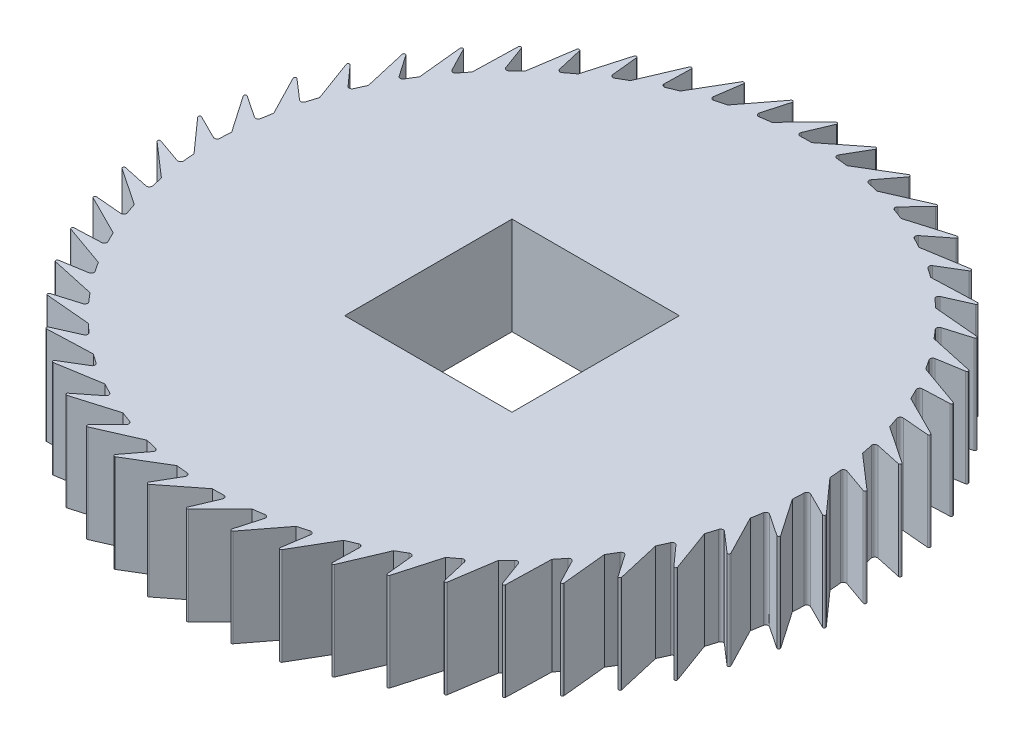
from build123d import *

# Parameters (mm, degrees)
EXTRUDE_1_DEPTH     = 7
FILLET_1_R          = 0.2
FILLET_2_R          = 0.2
FILLET_3_R          = 0.2
FILLET_4_R          = 0.2
FILLET_6_R          = 0.1
FILLET_7_R          = 0.1
FILLET_8_R          = 0.1
FILLET_9_R          = 0.1
SKETCH_2_W          = 12
SKETCH_2_H          = 12
CUT_EXTRUDE_1_DEPTH = 7


with BuildPart() as part:
    # 草图1 → 凸台-拉伸1 (new body)
    with BuildSketch(Plane(origin=(0, 0, 0), x_dir=(1, 0, 0), z_dir=(0, 1, 0))):
        with BuildLine():
            Line((0, 21.5), (2.952809581, 23.817659742))
            Line((2.952809581, 23.817659742), (1.573300118, 21.442358236))
            ThreePointArc((1.573300118, 21.442358236), (2.134715556, 21.393760527), (2.694664522, 21.330466078))
            Line((2.694664522, 21.330466078), (5.914670106, 23.259765208))
            Line((5.914670106, 23.259765208), (4.248334269, 21.076092046))
            ThreePointArc((4.248334269, 21.076092046), (4.799231871, 20.957513532), (5.346832574, 20.824537964))
            Line((5.346832574, 20.824537964), (8.783252751, 22.335050282))
            Line((8.783252751, 22.335050282), (6.856369652, 20.377443294))
            ThreePointArc((6.856369652, 20.377443294), (7.388061433, 20.190754029), (7.914677883, 19.990194447))
            Line((7.914677883, 19.990194447), (11.513318254, 21.058098271))
            Line((11.513318254, 21.058098271), (9.356275989, 19.357430088))
            ThreePointArc((9.356275989, 19.357430088), (9.860376852, 19.105574274), (10.357703993, 18.840593621))
            Line((10.357703993, 18.840593621), (14.06181185, 19.44904747))
            Line((14.06181185, 19.44904747), (11.708628265, 18.032138646))
            ThreePointArc((11.708628265, 18.032138646), (12.177188238, 17.719088199), (12.637382924, 17.393865379))
            Line((12.637382924, 17.393865379), (16.388542272, 17.533273573))
            Line((16.388542272, 17.533273573), (13.876328478, 16.422469606))
            ThreePointArc((13.876328478, 16.422469606), (14.301958092, 16.053161519), (14.717762777, 15.67282549))
            Line((14.717762777, 15.67282549), (18.456815593, 15.340989478))
            Line((18.456815593, 15.340989478), (15.825190702, 14.55380841))
            ThreePointArc((15.825190702, 14.55380841), (16.201177522, 14.134066891), (16.56603472, 13.70461578))
            Line((16.56603472, 13.70461578), (20.234013907, 12.906768814))
            Line((20.234013907, 12.906768814), (17.524480216, 12.455624961))
            ThreePointArc((17.524480216, 12.455624961), (17.844894706, 11.992069586), (18.153050398, 11.520276092))
            Line((18.153050398, 11.520276092), (21.692109734, 10.269000696))
            Line((21.692109734, 10.269000696), (18.947398207, 10.161008866))
            ThreePointArc((18.947398207, 10.161008866), (19.207187239, 9.660950179), (19.453781628, 9.154254769))
            Line((19.453781628, 9.154254769), (22.808108032, 7.469284302))
            Line((22.808108032, 7.469284302), (20.07150441, 7.706147591))
            ThreePointArc((20.07150441, 7.706147591), (20.266570956, 7.177471817), (20.4477151, 6.643865379))
            Line((20.4477151, 6.643865379), (23.564408842, 4.551772834))
            Line((23.564408842, 4.551772834), (20.879070999, 5.129755766))
            ThreePointArc((20.879070999, 5.129755766), (21.006338742, 4.580800437), (21.119175891, 4.028698264))
            Line((21.119175891, 4.028698264), (23.949084848, 1.562477188))
            Line((23.949084848, 1.562477188), (21.357362165, 2.472464627))
            ThreePointArc((21.357362165, 2.472464627), (21.414824018, 1.911887097), (21.457574661, 1.34999617))
            Line((21.457574661, 1.34999617), (23.956069479, -1.451459656))
            Line((23.956069479, -1.451459656), (21.498834972, -0.223818756))
            ThreePointArc((21.498834972, -0.223818756), (21.485584727, -0.787177844), (21.457574661, -1.34999617))
            Line((21.457574661, -1.34999617), (23.585252583, -4.442506115))
            Line((23.585252583, -4.442506115), (21.301258309, -2.916572383))
            ThreePointArc((21.301258309, -2.916572383), (21.217504929, -3.47382852), (21.119175891, -4.028698264))
            Line((21.119175891, -4.028698264), (22.842482166, -7.363491598))
            Line((22.842482166, -7.363491598), (20.767748077, -5.563329921))
            ThreePointArc((20.767748077, -5.563329921), (20.614812404, -6.105694846), (20.4477151, -6.643865379))
            Line((20.4477151, -6.643865379), (21.739472159, -10.168350419))
            Line((21.739472159, -10.168350419), (19.906718052, -8.122350423))
            ThreePointArc((19.906718052, -8.122350423), (19.687011973, -8.641270716), (19.453781628, -9.154254769))
            Line((19.453781628, -9.154254769), (20.29361769, -12.812848281))
            Line((20.29361769, -12.812848281), (18.731747192, -10.553276607))
            ThreePointArc((18.731747192, -10.553276607), (18.448735602, -11.040568585), (18.153050398, -11.520276092))
            Line((18.153050398, -11.520276092), (18.527720746, -15.255279871))
            Line((18.527720746, -15.255279871), (17.261365488, -12.817771315))
            ThreePointArc((17.261365488, -12.817771315), (16.91951165, -13.265750093), (16.56603472, -13.70461578))
            Line((16.56603472, -13.70461578), (16.469630579, -17.457126584))
            Line((16.469630579, -17.457126584), (15.51876174, -14.880122112))
            ThreePointArc((15.51876174, -14.880122112), (15.123456892, -15.281722796), (14.717762777, -15.67282549))
            Line((14.717762777, -15.67282549), (14.151804499, -19.383663983))
            Line((14.151804499, -19.383663983), (13.531417848, -16.707804495))
            ThreePointArc((13.531417848, -16.707804495), (13.088896185, -17.056693603), (12.637382924, -17.393865379))
            Line((12.637382924, -17.393865379), (11.610796009, -21.004509422))
            Line((11.610796009, -21.004509422), (11.330675413, -18.271994819))
            ThreePointArc((11.330675413, -18.271994819), (10.847915766, -18.562670162), (10.357703993, -18.840593621))
            Line((10.357703993, -18.840593621), (8.886678329, -22.294101199))
            Line((8.886678329, -22.294101199), (8.951241459, -19.548024871))
            ThreePointArc((8.951241459, -19.548024871), (8.435857235, -19.775902323), (7.914677883, -19.990194447))
            Line((7.914677883, -19.990194447), (6.022412423, -23.232101683))
            Line((6.022412423, -23.232101683), (6.43064108, -20.515770892))
            ThreePointArc((6.43064108, -20.515770892), (5.890760197, -20.677256692), (5.346832574, -20.824537964))
            Line((5.346832574, -20.824537964), (3.063169476, -23.803718045))
            Line((3.063169476, -23.803718045), (3.808625649, -21.159970951))
            ThreePointArc((3.808625649, -21.159970951), (3.25276235, -21.252518371), (2.694664522, -21.330466078))
            Line((2.694664522, -21.330466078), (0.055618516, -23.999935554))
            Line((0.055618516, -23.999935554), (1.126545917, -21.470465628))
            ThreePointArc((1.126545917, -21.470465628), (0.563466499, -21.492615139), (0, -21.5))
            Line((0, -21.5), (-2.952809581, -23.817659742))
            Line((-2.952809581, -23.817659742), (-1.573300118, -21.442358236))
            ThreePointArc((-1.573300118, -21.442358236), (-2.134715556, -21.393760527), (-2.694664522, -21.330466078))
            Line((-2.694664522, -21.330466078), (-5.914670106, -23.259765208))
            Line((-5.914670106, -23.259765208), (-4.248334269, -21.076092046))
            ThreePointArc((-4.248334269, -21.076092046), (-4.799231871, -20.957513532), (-5.346832574, -20.824537964))
            Line((-5.346832574, -20.824537964), (-8.783252751, -22.335050282))
            Line((-8.783252751, -22.335050282), (-6.856369652, -20.377443294))
            ThreePointArc((-6.856369652, -20.377443294), (-7.388061433, -20.190754029), (-7.914677883, -19.990194447))
            Line((-7.914677883, -19.990194447), (-11.513318254, -21.058098271))
            Line((-11.513318254, -21.058098271), (-9.356275989, -19.357430088))
            ThreePointArc((-9.356275989, -19.357430088), (-9.860376852, -19.105574274), (-10.357703993, -18.840593621))
            Line((-10.357703993, -18.840593621), (-14.06181185, -19.44904747))
            Line((-14.06181185, -19.44904747), (-11.708628265, -18.032138646))
            ThreePointArc((-11.708628265, -18.032138646), (-12.177188238, -17.719088199), (-12.637382924, -17.393865379))
            Line((-12.637382924, -17.393865379), (-16.388542272, -17.533273573))
            Line((-16.388542272, -17.533273573), (-13.876328478, -16.422469606))
            ThreePointArc((-13.876328478, -16.422469606), (-14.301958092, -16.053161519), (-14.717762777, -15.67282549))
            Line((-14.717762777, -15.67282549), (-18.456815593, -15.340989478))
            Line((-18.456815593, -15.340989478), (-15.825190702, -14.55380841))
            ThreePointArc((-15.825190702, -14.55380841), (-16.201177522, -14.134066891), (-16.56603472, -13.70461578))
            Line((-16.56603472, -13.70461578), (-20.234013907, -12.906768814))
            Line((-20.234013907, -12.906768814), (-17.524480216, -12.455624961))
            ThreePointArc((-17.524480216, -12.455624961), (-17.844894706, -11.992069586), (-18.153050398, -11.520276092))
            Line((-18.153050398, -11.520276092), (-21.692109734, -10.269000696))
            Line((-21.692109734, -10.269000696), (-18.947398207, -10.161008866))
            ThreePointArc((-18.947398207, -10.161008866), (-19.207187239, -9.660950179), (-19.453781628, -9.154254769))
            Line((-19.453781628, -9.154254769), (-22.808108032, -7.469284302))
            Line((-22.808108032, -7.469284302), (-20.07150441, -7.706147591))
            ThreePointArc((-20.07150441, -7.706147591), (-20.266570956, -7.177471817), (-20.4477151, -6.643865379))
            Line((-20.4477151, -6.643865379), (-23.564408842, -4.551772834))
            Line((-23.564408842, -4.551772834), (-20.879070999, -5.129755766))
            ThreePointArc((-20.879070999, -5.129755766), (-21.006338742, -4.580800437), (-21.119175891, -4.028698264))
            Line((-21.119175891, -4.028698264), (-23.949084848, -1.562477188))
            Line((-23.949084848, -1.562477188), (-21.357362165, -2.472464627))
            ThreePointArc((-21.357362165, -2.472464627), (-21.414824018, -1.911887097), (-21.457574661, -1.34999617))
            Line((-21.457574661, -1.34999617), (-23.956069479, 1.451459656))
            Line((-23.956069479, 1.451459656), (-21.498834972, 0.223818756))
            ThreePointArc((-21.498834972, 0.223818756), (-21.485584727, 0.787177844), (-21.457574661, 1.34999617))
            Line((-21.457574661, 1.34999617), (-23.585252583, 4.442506115))
            Line((-23.585252583, 4.442506115), (-21.301258309, 2.916572383))
            ThreePointArc((-21.301258309, 2.916572383), (-21.217504929, 3.47382852), (-21.119175891, 4.028698264))
            Line((-21.119175891, 4.028698264), (-22.842482166, 7.363491598))
            Line((-22.842482166, 7.363491598), (-20.767748077, 5.563329921))
            ThreePointArc((-20.767748077, 5.563329921), (-20.614812404, 6.105694846), (-20.4477151, 6.643865379))
            Line((-20.4477151, 6.643865379), (-21.739472159, 10.168350419))
            Line((-21.739472159, 10.168350419), (-19.906718052, 8.122350423))
            ThreePointArc((-19.906718052, 8.122350423), (-19.687011973, 8.641270716), (-19.453781628, 9.154254769))
            Line((-19.453781628, 9.154254769), (-20.29361769, 12.812848281))
            Line((-20.29361769, 12.812848281), (-18.731747192, 10.553276607))
            ThreePointArc((-18.731747192, 10.553276607), (-18.448735602, 11.040568585), (-18.153050398, 11.520276092))
            Line((-18.153050398, 11.520276092), (-18.527720746, 15.255279871))
            Line((-18.527720746, 15.255279871), (-17.261365488, 12.817771315))
            ThreePointArc((-17.261365488, 12.817771315), (-16.91951165, 13.265750093), (-16.56603472, 13.70461578))
            Line((-16.56603472, 13.70461578), (-16.469630579, 17.457126584))
            Line((-16.469630579, 17.457126584), (-15.51876174, 14.880122112))
            ThreePointArc((-15.51876174, 14.880122112), (-15.123456892, 15.281722796), (-14.717762777, 15.67282549))
            Line((-14.717762777, 15.67282549), (-14.151804499, 19.383663983))
            Line((-14.151804499, 19.383663983), (-13.531417848, 16.707804495))
            ThreePointArc((-13.531417848, 16.707804495), (-13.088896185, 17.056693603), (-12.637382924, 17.393865379))
            Line((-12.637382924, 17.393865379), (-11.610796009, 21.004509422))
            Line((-11.610796009, 21.004509422), (-11.330675413, 18.271994819))
            ThreePointArc((-11.330675413, 18.271994819), (-10.847915766, 18.562670162), (-10.357703993, 18.840593621))
            Line((-10.357703993, 18.840593621), (-8.886678329, 22.294101199))
            Line((-8.886678329, 22.294101199), (-8.951241459, 19.548024871))
            ThreePointArc((-8.951241459, 19.548024871), (-8.435857235, 19.775902323), (-7.914677883, 19.990194447))
            Line((-7.914677883, 19.990194447), (-6.022412423, 23.232101683))
            Line((-6.022412423, 23.232101683), (-6.43064108, 20.515770892))
            ThreePointArc((-6.43064108, 20.515770892), (-5.890760197, 20.677256692), (-5.346832574, 20.824537964))
            Line((-5.346832574, 20.824537964), (-3.063169476, 23.803718045))
            Line((-3.063169476, 23.803718045), (-3.808625649, 21.159970951))
            ThreePointArc((-3.808625649, 21.159970951), (-3.25276235, 21.252518371), (-2.694664522, 21.330466078))
            Line((-2.694664522, 21.330466078), (-0.055618516, 23.999935554))
            Line((-0.055618516, 23.999935554), (-1.126545917, 21.470465628))
            ThreePointArc((-1.126545917, 21.470465628), (-0.563466499, 21.492615139), (0, 21.5))
        make_face()
    extrude(amount=EXTRUDE_1_DEPTH)

    # 圆角1
    fillet_1_edges = [part.edges().sort_by_distance(p)[0] for p in [
        (1.573300118, 3.5, -21.442358236),
        (4.248334269, 3.5, -21.076092046),
        (-21.301258309, 3.5, -2.916572383),
        (-20.767748077, 3.5, -5.563329921),
        (-19.906718052, 3.5, -8.122350423),
        (-18.731747192, 3.5, -10.553276607),
        (-17.261365488, 3.5, -12.817771315),
        (-15.51876174, 3.5, -14.880122112),
        (-13.531417848, 3.5, -16.707804495),
        (-11.330675413, 3.5, -18.271994819),
        (-8.951241459, 3.5, -19.548024871),
        (-6.43064108, 3.5, -20.515770892),
        (-3.808625649, 3.5, -21.159970951),
        (-1.126545917, 3.5, -21.470465628),
    ]]
    fillet(fillet_1_edges, radius=FILLET_1_R)

    # 圆角2
    fillet_2_edges = [part.edges().sort_by_distance(p)[0] for p in [
        (1.126545917, 3.5, 21.470465628),
        (-1.573300118, 3.5, 21.442358236),
        (-4.248334269, 3.5, 21.076092046),
        (-6.856369652, 3.5, 20.377443294),
        (-9.356275989, 3.5, 19.357430088),
        (-11.708628265, 3.5, 18.032138646),
        (-13.876328478, 3.5, 16.422469606),
        (-15.825190702, 3.5, 14.55380841),
        (-17.524480216, 3.5, 12.455624961),
        (-18.947398207, 3.5, 10.161008866),
        (-20.07150441, 3.5, 7.706147591),
        (-20.879070999, 3.5, 5.129755766),
        (-21.357362165, 3.5, 2.472464627),
        (-21.498834972, 3.5, -0.223818756),
    ]]
    fillet(fillet_2_edges, radius=FILLET_2_R)

    # 圆角3
    fillet_3_edges = [part.edges().sort_by_distance(p)[0] for p in [
        (20.879070999, 3.5, -5.129755766),
        (21.357362165, 3.5, -2.472464627),
        (21.498834972, 3.5, 0.223818756),
        (21.301258309, 3.5, 2.916572383),
        (20.767748077, 3.5, 5.563329921),
        (19.906718052, 3.5, 8.122350423),
        (18.731747192, 3.5, 10.553276607),
        (17.261365488, 3.5, 12.817771315),
        (15.51876174, 3.5, 14.880122112),
        (13.531417848, 3.5, 16.707804495),
        (11.330675413, 3.5, 18.271994819),
        (8.951241459, 3.5, 19.548024871),
        (6.43064108, 3.5, 20.515770892),
        (3.808625649, 3.5, 21.159970951),
    ]]
    fillet(fillet_3_edges, radius=FILLET_3_R)

    # 圆角4
    fillet_4_edges = [part.edges().sort_by_distance(p)[0] for p in [
        (6.856369652, 3.5, -20.377443294),
        (9.356275989, 3.5, -19.357430088),
        (11.708628265, 3.5, -18.032138646),
        (13.876328478, 3.5, -16.422469606),
        (15.825190702, 3.5, -14.55380841),
        (17.524480216, 3.5, -12.455624961),
        (18.947398207, 3.5, -10.161008866),
        (20.07150441, 3.5, -7.706147591),
    ]]
    fillet(fillet_4_edges, radius=FILLET_4_R)

    # 圆角6
    fillet_6_edges = [part.edges().sort_by_distance(p)[0] for p in [
        (-18.456815593, 3.5, 15.340989478),
    ]]
    fillet(fillet_6_edges, radius=FILLET_6_R)

    # 圆角7
    fillet_7_edges = [part.edges().sort_by_distance(p)[0] for p in [
        (23.949084848, 3.5, -1.562477188),
        (23.956069479, 3.5, 1.451459656),
        (23.585252583, 3.5, 4.442506115),
        (22.842482166, 3.5, 7.363491598),
        (21.739472159, 3.5, 10.168350419),
        (20.29361769, 3.5, 12.812848281),
        (18.527720746, 3.5, 15.255279871),
        (16.469630579, 3.5, 17.457126584),
        (14.151804499, 3.5, 19.383663983),
        (11.610796009, 3.5, 21.004509422),
        (8.886678329, 3.5, 22.294101199),
        (6.022412423, 3.5, 23.232101683),
        (3.063169476, 3.5, 23.803718045),
        (0.055618516, 3.5, 23.999935554),
        (-2.952809581, 3.5, 23.817659742),
        (-5.914670106, 3.5, 23.259765208),
        (-8.783252751, 3.5, 22.335050282),
        (-11.513318254, 3.5, 21.058098271),
        (-14.06181185, 3.5, 19.44904747),
        (-16.388542272, 3.5, 17.533273573),
    ]]
    fillet(fillet_7_edges, radius=FILLET_7_R)

    # 圆角8
    fillet_8_edges = [part.edges().sort_by_distance(p)[0] for p in [
        (2.952809581, 3.5, -23.817659742),
        (5.914670106, 3.5, -23.259765208),
        (8.783252751, 3.5, -22.335050282),
        (11.513318254, 3.5, -21.058098271),
        (14.06181185, 3.5, -19.44904747),
        (16.388542272, 3.5, -17.533273573),
        (18.456815593, 3.5, -15.340989478),
        (20.234013907, 3.5, -12.906768814),
        (21.692109734, 3.5, -10.269000696),
        (22.808108032, 3.5, -7.469284302),
        (23.564408842, 3.5, -4.551772834),
        (-20.29361769, 3.5, -12.812848281),
        (-18.527720746, 3.5, -15.255279871),
        (-16.469630579, 3.5, -17.457126584),
        (-14.151804499, 3.5, -19.383663983),
        (-11.610796009, 3.5, -21.004509422),
        (-8.886678329, 3.5, -22.294101199),
        (-6.022412423, 3.5, -23.232101683),
        (-3.063169476, 3.5, -23.803718045),
        (-0.055618516, 3.5, -23.999935554),
    ]]
    fillet(fillet_8_edges, radius=FILLET_8_R)

    # 圆角9
    fillet_9_edges = [part.edges().sort_by_distance(p)[0] for p in [
        (-20.234013907, 3.5, 12.906768814),
        (-21.692109734, 3.5, 10.269000696),
        (-22.808108032, 3.5, 7.469284302),
        (-23.564408842, 3.5, 4.551772834),
        (-23.949084848, 3.5, 1.562477188),
        (-23.956069479, 3.5, -1.451459656),
        (-23.585252583, 3.5, -4.442506115),
        (-22.842482166, 3.5, -7.363491598),
        (-21.739472159, 3.5, -10.168350419),
    ]]
    fillet(fillet_9_edges, radius=FILLET_9_R)

    # 草图2 → 切除-拉伸1 (cut)
    with BuildSketch(Plane(origin=(0, 7, 0), x_dir=(1, 0, 0), z_dir=(0, 1, 0))):
        Rectangle(SKETCH_2_W, SKETCH_2_H)
    extrude(amount=-CUT_EXTRUDE_1_DEPTH, mode=Mode.SUBTRACT)


solid = part.part
